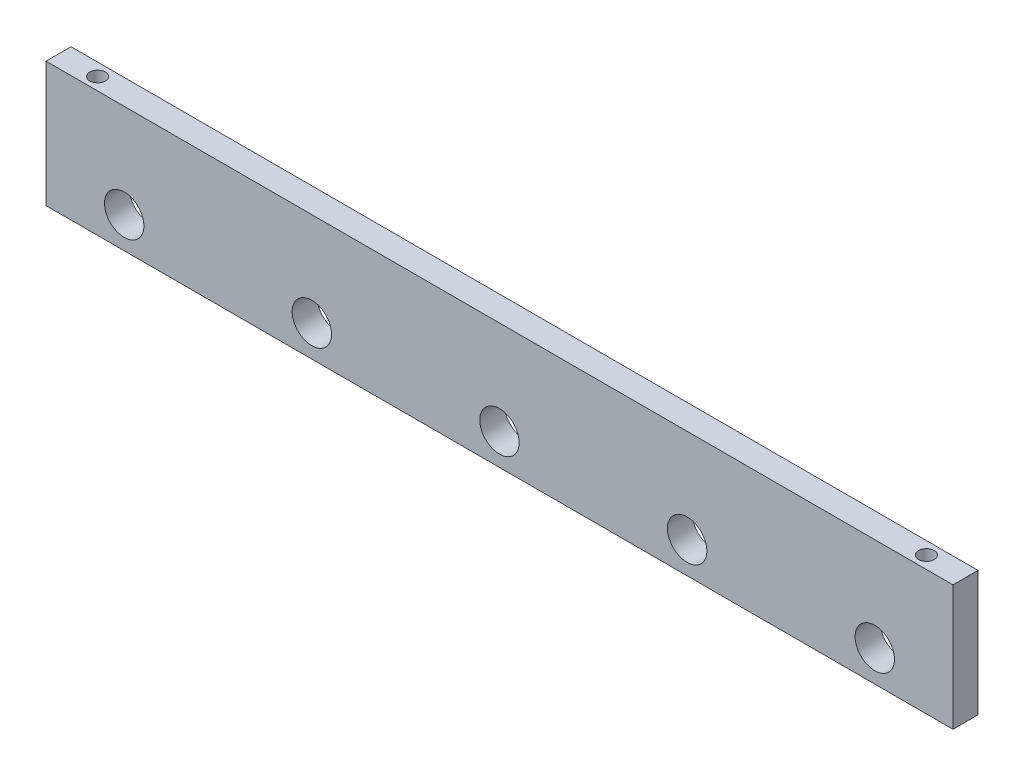
from build123d import *

# Parameters (mm, degrees)
SKETCH1_W           = 580
SKETCH1_H           = 80
SKETCH1_R           = 12.6
BOSS_EXTRUDE1_DEPTH = 8
SKETCH2_R           = 5
CUT_EXTRUDE1_DEPTH  = 301.93853193


with BuildPart() as part:
    # Sketch1 → Boss-Extrude1 (new, symmetric)
    with BuildSketch(Plane.XY):
        Rectangle(SKETCH1_W, SKETCH1_H)
        with Locations((-240, -20)):
            Circle(SKETCH1_R, mode=Mode.SUBTRACT)
        with Locations((-120, -20)):
            Circle(SKETCH1_R, mode=Mode.SUBTRACT)
        with Locations((0, -20)):
            Circle(SKETCH1_R, mode=Mode.SUBTRACT)
        with Locations((120, -20)):
            Circle(SKETCH1_R, mode=Mode.SUBTRACT)
        with Locations((240, -20)):
            Circle(SKETCH1_R, mode=Mode.SUBTRACT)
    extrude(amount=BOSS_EXTRUDE1_DEPTH, both=True)

    # Sketch2 → Cut-Extrude1 (cut, through all)
    with BuildSketch(Plane(origin=(0, 40, 0), x_dir=(1, 0, 0), z_dir=(0, 1, 0))):
        with Locations((-265, 0)):
            Circle(SKETCH2_R)
        with Locations((265, 0)):
            Circle(SKETCH2_R)
    extrude(amount=-CUT_EXTRUDE1_DEPTH, mode=Mode.SUBTRACT)


solid = part.part
